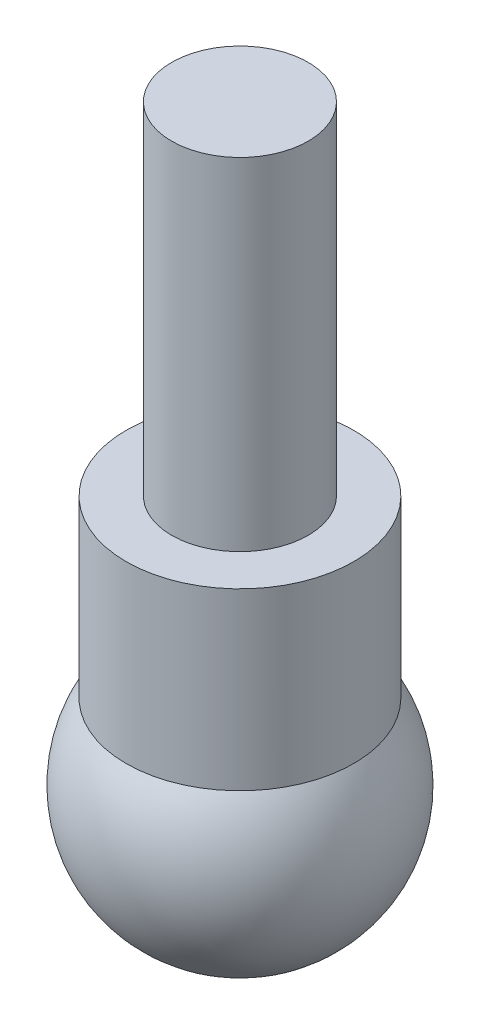
from build123d import *


with BuildPart() as part:
    # 草图1 → 旋转1 (revolve)
    with BuildSketch(Plane.XY, mode=Mode.PRIVATE) as revolve_1_sk:
        with BuildLine():
            Line((0, 26), (3, 26))
            Line((3, 26), (3, 11))
            Line((3, 11), (5, 11))
            Line((5, 11), (5, 3.31662479))
            ThreePointArc((5, 3.31662479), (5.286764074, -2.837274331), (0, -6))
            Line((0, -6), (0, 6))
            Line((0, 6), (0, 26))
        make_face()
    revolve(revolve_1_sk.sketch.rotate(Axis((0, 26, 0), (0, -1, 0)), 90), axis=Axis((0, 26, 0), (0, -1, 0)))


solid = part.part
